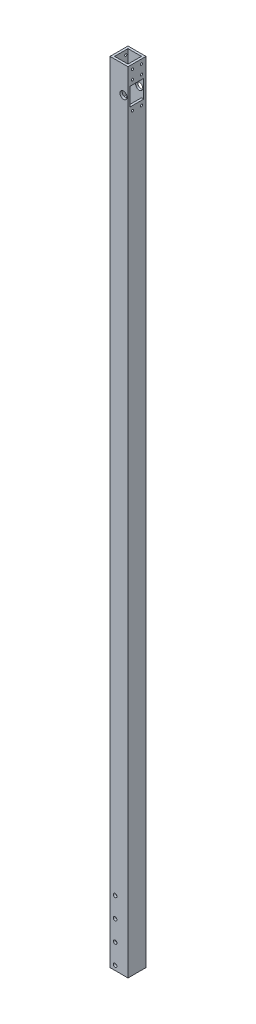
from build123d import *

# Parameters (mm, degrees)
SKETCH1_W                    = 25.4
SKETCH1_H                    = 25.4
SKETCH1_W_2                  = 19.05
SKETCH1_H_2                  = 19.05
BOSS_EXTRUDE1_DEPTH          = 1117.6
CUT_EXTRUDE1_REACH           = 1119.961
SKETCH2_W                    = 19.05
SKETCH2_H                    = 25.4
F_3_8_CLEARANCE_HOLE1_D      = 10.0838
F_10_CLEARANCE_HOLE1_REACH   = 1502.875
F_10_CLEARANCE_HOLE1_BORE_R  = 2.5527
F_1_8_0_125_DIAMETER_HOLE1_D = 3.175
F_10_CLEARANCE_HOLE2_D       = 5.1054


with BuildPart() as part:
    # Sketch1 → Boss-Extrude1 (new body)
    with BuildSketch(Plane(origin=(0, 0, 0), x_dir=(1, 0, 0), z_dir=(0, 1, 0))):
        Rectangle(SKETCH1_W, SKETCH1_H)
        Rectangle(SKETCH1_W_2, SKETCH1_H_2, mode=Mode.SUBTRACT)
    extrude(amount=BOSS_EXTRUDE1_DEPTH)

    # Sketch2 → Cut-Extrude1 (cut, up to next)
    with BuildSketch(Plane(origin=(12.7, 0, 0), x_dir=(0, 0, -1), z_dir=(1, 0, 0)), mode=Mode.PRIVATE) as cut_extrude1_sk1:
        with Locations((0, 1079.5)):
            Rectangle(SKETCH2_W, SKETCH2_H)
    cut_extrude1_tool1 = extrude(cut_extrude1_sk1.sketch, amount=-CUT_EXTRUDE1_REACH, mode=Mode.PRIVATE) & part.part
    add(cut_extrude1_tool1.solids().sort_by_distance((12.7, 1079.5, 0))[0], mode=Mode.SUBTRACT)

    # 3/8 Clearance Hole1 (through all)
    with Locations(Plane.XY.offset(12.7)):
        with Locations((6.35, 1079.5)):
            Hole(F_3_8_CLEARANCE_HOLE1_D / 2)

    # #10 Clearance Hole1 bore → #10 Clearance Hole1 (cut, up to next)
    with BuildSketch(Plane(origin=(-12.7, -56.379087674, -922.047250894), x_dir=(0, 0, 1), z_dir=(-1, 0, 0)), mode=Mode.PRIVATE) as f_10_clearance_hole1_sk1:
        with Locations((922.047250894, 138.929087674)):
            Circle(F_10_CLEARANCE_HOLE1_BORE_R)
    f_10_clearance_hole1_tool1 = extrude(f_10_clearance_hole1_sk1.sketch, amount=-F_10_CLEARANCE_HOLE1_REACH, mode=Mode.PRIVATE) & part.part
    # #10 Clearance Hole1 bore → #10 Clearance Hole1 (cut, up to next)
    with BuildSketch(Plane(origin=(-12.7, -56.379087674, -922.047250894), x_dir=(0, 0, 1), z_dir=(-1, 0, 0)), mode=Mode.PRIVATE) as f_10_clearance_hole1_sk2:
        with Locations((922.047250894, 113.529087674)):
            Circle(F_10_CLEARANCE_HOLE1_BORE_R)
    f_10_clearance_hole1_tool2 = extrude(f_10_clearance_hole1_sk2.sketch, amount=-F_10_CLEARANCE_HOLE1_REACH, mode=Mode.PRIVATE) & part.part
    # #10 Clearance Hole1 bore → #10 Clearance Hole1 (cut, up to next)
    with BuildSketch(Plane(origin=(-12.7, -56.379087674, -922.047250894), x_dir=(0, 0, 1), z_dir=(-1, 0, 0)), mode=Mode.PRIVATE) as f_10_clearance_hole1_sk3:
        with Locations((922.047250894, 69.079087674)):
            Circle(F_10_CLEARANCE_HOLE1_BORE_R)
    f_10_clearance_hole1_tool3 = extrude(f_10_clearance_hole1_sk3.sketch, amount=-F_10_CLEARANCE_HOLE1_REACH, mode=Mode.PRIVATE) & part.part
    add(f_10_clearance_hole1_tool1.solids().sort_by_distance((-12.7, 82.55, 0))[0], mode=Mode.SUBTRACT)
    add(f_10_clearance_hole1_tool2.solids().sort_by_distance((-12.7, 57.15, 0))[0], mode=Mode.SUBTRACT)
    add(f_10_clearance_hole1_tool3.solids().sort_by_distance((-12.7, 12.7, 0))[0], mode=Mode.SUBTRACT)

    # 1/8 (0.125) Diameter Hole1 (through all)
    with Locations(Plane(origin=(12.7, 0, 0), x_dir=(0, 0, -1), z_dir=(1, 0, 0))):
        with Locations((6.35, 1060.45), (6.35, 1098.55), (-6.35, 1111.25), (-6.35, 1098.55), (6.35, 1111.25), (-6.35, 1060.45)):
            Hole(F_1_8_0_125_DIAMETER_HOLE1_D / 2)

    # #10 Clearance Hole2 (through all)
    with Locations(Plane.XY.offset(12.7)):
        with Locations((112.944997341, 382.363477044), (-5.55625, 6.35), (-5.55625, 34.925), (-5.55625, 92.075), (-5.55625, 63.5)):
            Hole(F_10_CLEARANCE_HOLE2_D / 2)


solid = part.part
